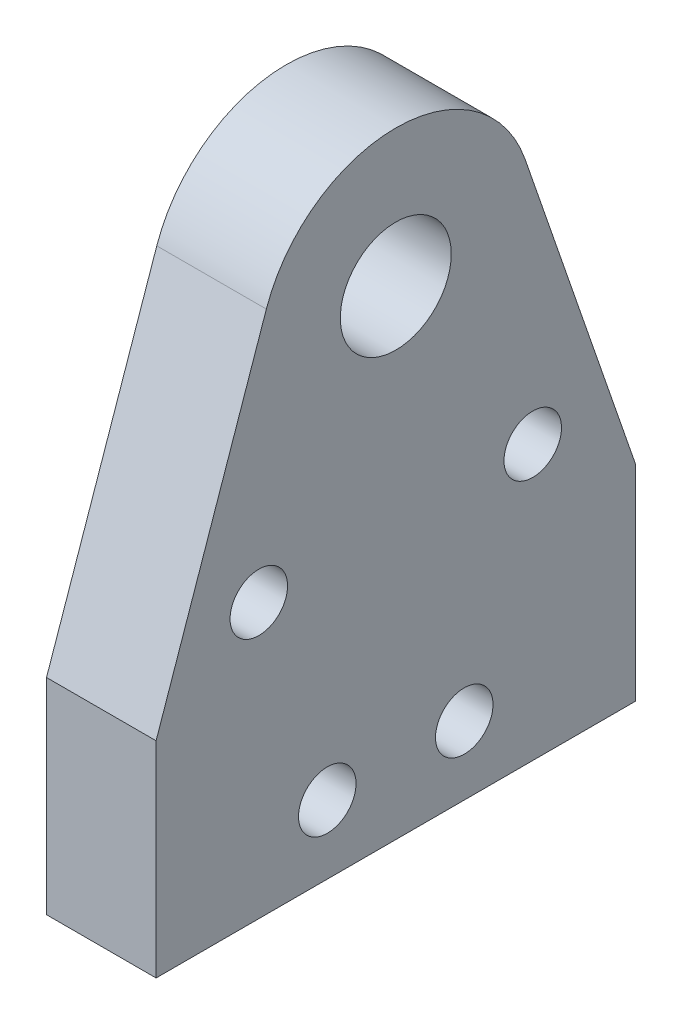
from build123d import *

# Parameters (mm, degrees)
SKETCH_1_W          = 8
SKETCH_1_H          = 35
EXTRUDE_1_DEPTH     = 60
CUT_EXTRUDE_1_DEPTH = 60
SKETCH_3_R          = 2.1
CUT_EXTRUDE_2_DEPTH = 10
SKETCH_4_R          = 4.05
CUT_EXTRUDE_3_DEPTH = 46
SKETCH_5_R          = 2.1
CUT_EXTRUDE_4_DEPTH = 10
SKETCH_7_R          = 4.05
EXTRUDE_2_DEPTH     = 2


with BuildPart() as part:
    # 草图1 → 凸台-拉伸1 (new body)
    with BuildSketch(Plane(origin=(0, 0, 0), x_dir=(1, 0, 0), z_dir=(0, 1, 0))):
        Rectangle(SKETCH_1_W, SKETCH_1_H)
    extrude(amount=EXTRUDE_1_DEPTH)

    # 草图2 → 切除-拉伸1 (cut)
    with BuildSketch(Plane(origin=(4, 0, 0), x_dir=(0, 0, -1), z_dir=(1, 0, 0))):
        with BuildLine():
            Line((-17.5, 15), (-9.450518874, 38.269203727))
            ThreePointArc((-9.450518874, 38.269203727), (-1.17e-07, 45), (9.450518798, 38.269203948))
            Line((9.450518798, 38.269203948), (17.5, 15))
            Line((17.5, 15), (17.5, 60))
            Line((17.5, 60), (-17.5, 60))
            Line((-17.5, 60), (-17.5, 15))
        make_face()
    extrude(amount=-CUT_EXTRUDE_1_DEPTH, mode=Mode.SUBTRACT)

    # 草图3 → 切除-拉伸2 (cut)
    with BuildSketch(Plane.XZ):
        with Locations(Location((0, -12.5, 0), (0, 0, 270))):
            Circle(SKETCH_3_R)
        with Locations(Location((0, 12.5, 0), (0, 0, 270))):
            Circle(SKETCH_3_R)
    extrude(amount=-CUT_EXTRUDE_2_DEPTH, mode=Mode.SUBTRACT)

    # 草图4 → 切除-拉伸3 (cut)
    with BuildSketch(Plane(origin=(4, 0, 0), x_dir=(0, 0, -1), z_dir=(1, 0, 0))):
        with Locations((0, 35)):
            Circle(SKETCH_4_R)
    extrude(amount=-CUT_EXTRUDE_3_DEPTH, mode=Mode.SUBTRACT)

    # 草图5 → 切除-拉伸4 (cut)
    with BuildSketch(Plane.ZY.offset(4)):
        with Locations((10, 20)):
            Circle(SKETCH_5_R)
        with Locations((-10, 20)):
            Circle(SKETCH_5_R)
        with Locations((5, 5)):
            Circle(SKETCH_5_R)
        with Locations((-5, 5)):
            Circle(SKETCH_5_R)
    extrude(amount=-CUT_EXTRUDE_4_DEPTH, mode=Mode.SUBTRACT)


with BuildPart() as body_2:
    # 草图7 → 凸台-拉伸2 (new body)
    with BuildSketch(Plane.ZY.offset(4)):
        with Locations(Location((0, 35, 0), (0, 0, 180))):
            Circle(SKETCH_7_R)
    extrude(amount=-EXTRUDE_2_DEPTH)

    # Combine 3: union part
    add(part.part)


solid = body_2.part
